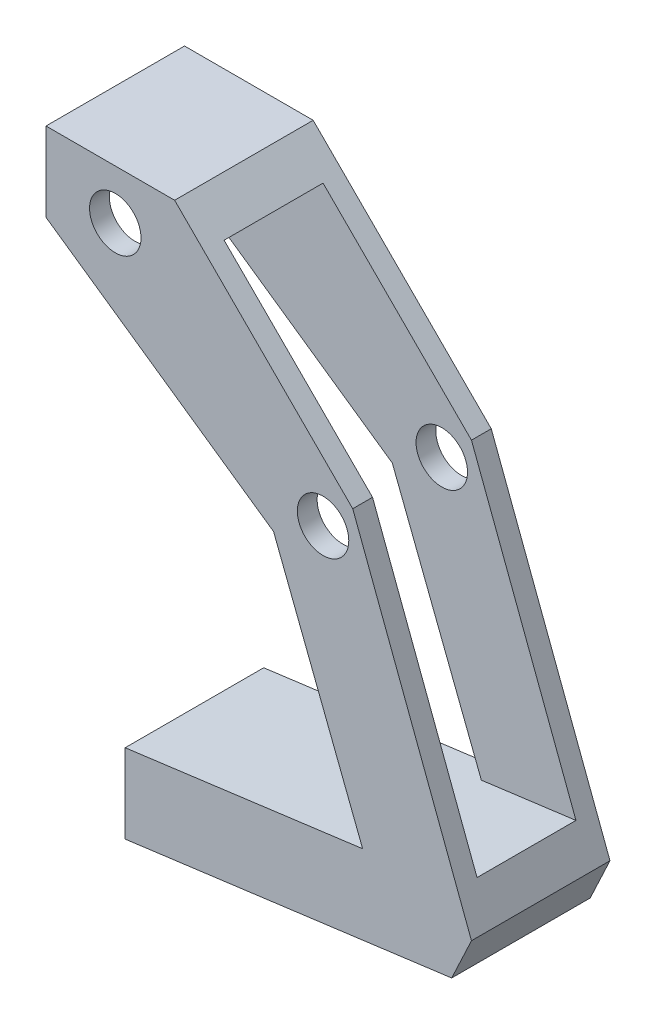
from build123d import *

# Parameters (mm, degrees)
EXTRUDE_2_DEPTH                = 14
FORK_ABOVE_MOUNTING_FOOT_DEPTH = 5
SKETCH_4_R                     = 2.6
OUTER_PIVOT_BORE_DEPTH         = 83.58934556
SKETCH_5_R                     = 2.6
UPPER_HINGE_BORE_DEPTH         = 83.58934556


with BuildPart() as part:
    # 草图1 → Extrude 2 (new body)
    with BuildSketch(Plane.XY):
        Polygon((12, 60), (25, 60), (43, 42), (55, 10.187667387), (53, 5.924362391), (20, 1.579829971), (20, 9.579829971), (44, 12.739489913), (35, 36), (12, 52), align=None)
    extrude(amount=EXTRUDE_2_DEPTH)

    # 草图3 → Fork_above_mounting_foot (cut, symmetric)
    with BuildSketch(Plane.XY.offset(7)):
        Polygon((-5, 6.288517531), (65, 15.504192362), (65, 57), (-5, 57), align=None)
    extrude(amount=FORK_ABOVE_MOUNTING_FOOT_DEPTH, both=True, mode=Mode.SUBTRACT)

    # 草图4 → Outer_pivot_bore (cut, through all)
    with BuildSketch(Plane.XY.offset(14)):
        with Locations((40, 39)):
            Circle(SKETCH_4_R)
    extrude(amount=-OUTER_PIVOT_BORE_DEPTH, mode=Mode.SUBTRACT)

    # 草图5 → Upper_hinge_bore (cut, through all)
    with BuildSketch(Plane.XY.offset(14)):
        with Locations((19, 55)):
            Circle(SKETCH_5_R)
    extrude(amount=-UPPER_HINGE_BORE_DEPTH, mode=Mode.SUBTRACT)


solid = part.part
